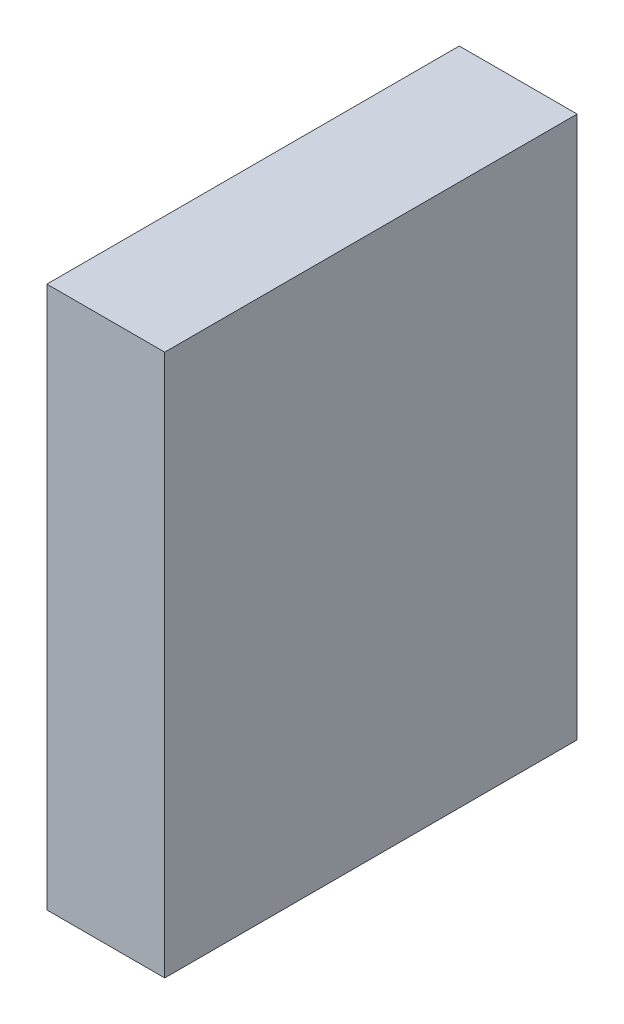
from build123d import *

# Parameters (mm, degrees)
SKETCH1_W           = 35
SKETCH1_H           = 46
BOSS_EXTRUDE1_DEPTH = 10


with BuildPart() as part:
    # Sketch1 → Boss-Extrude1 (new body)
    with BuildSketch(Plane(origin=(0, 0, 0), x_dir=(0, 0, -1), z_dir=(1, 0, 0))):
        Rectangle(SKETCH1_W, SKETCH1_H)
    extrude(amount=BOSS_EXTRUDE1_DEPTH)


solid = part.part
